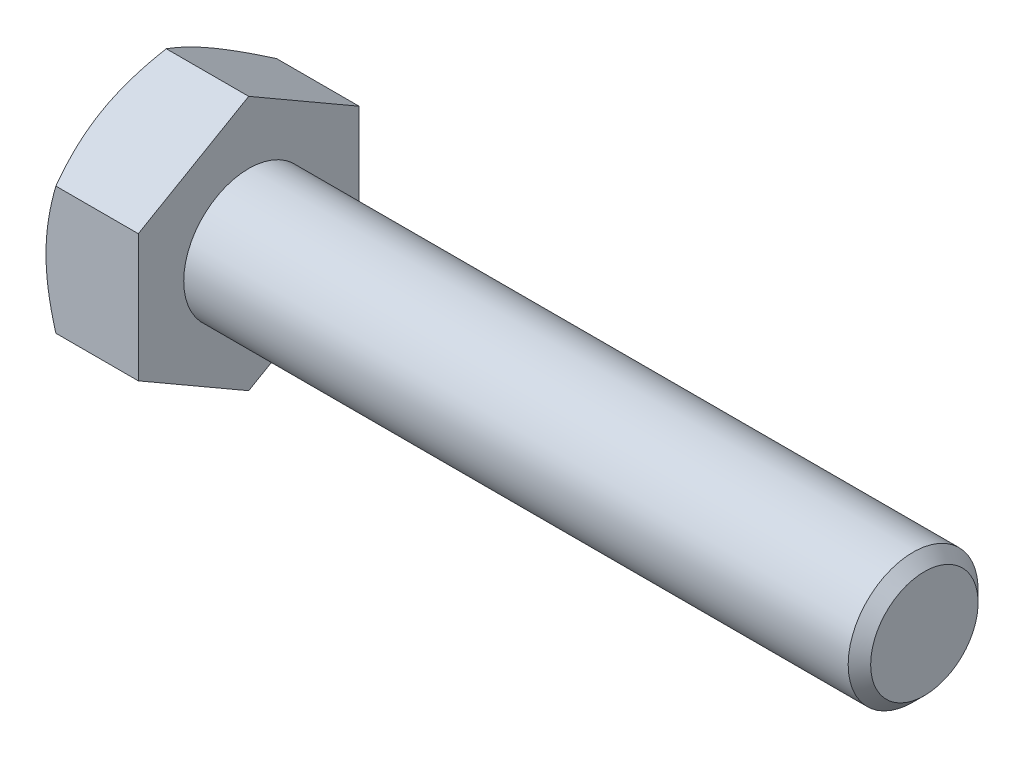
from build123d import *

# Parameters (mm, degrees)
BASEHEAD_DEPTH = 11.2776


with BuildPart() as part:
    # Sketch1 → BaseHead (new body)
    with BuildSketch(Plane(origin=(0, 0, 0), x_dir=(0, 0, -1), z_dir=(1, 0, 0))):
        Polygon((13.4874, 7.786954021), (13.4874, -7.786954021), (0, -15.573908041), (-13.4874, -7.786954021), (-13.4874, 7.786954021), (0, 15.573908041), align=None)
    extrude(amount=BASEHEAD_DEPTH)

    # BodySke → BaseBody (revolve)
    with BuildSketch(Plane.XY, mode=Mode.PRIVATE) as basebody_sk:
        Polygon((0, 0), (93.8276, 0), (93.8276, 6.56336), (92.45346, 7.9375), (0, 7.9375), align=None)
    revolve(basebody_sk.sketch.rotate(Axis((0, 0, 0), (1, 0, 0)), 90), axis=Axis((0, 0, 0), (1, 0, 0)))

    # Sketch3 → HeadChamfer (revolve, cut)
    with BuildSketch(Plane.XY):
        Polygon((0, 13.4874), (4.870820189, 21.923908041), (4.870820189, 28.273908041), (-12.7, 28.273908041), (-12.7, 13.4874), align=None)
    revolve(axis=Axis((0, 0, 0), (1, 0, 0)), mode=Mode.SUBTRACT)


solid = part.part
